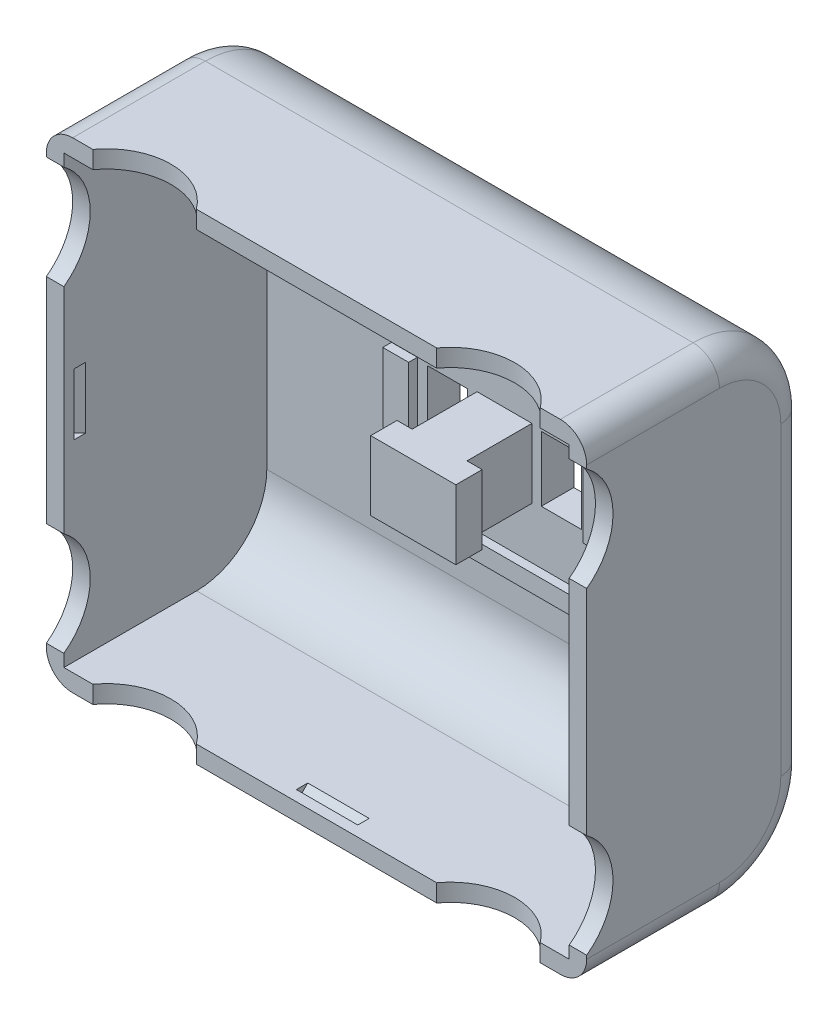
from build123d import *

# Parameters (mm, degrees)
EXTRUDE_1_DEPTH     = 61.6
SHELL_1_T           = -2
FILLET_2_R          = 3
CUT_EXTRUDE_1_REACH = 88.192
SKETCH_3_W          = 4.6
SKETCH_3_H          = 7.4
SKETCH_4_W          = 4.6
SKETCH_4_H          = 7.4
EXTRUDE_2_DEPTH     = 1.7
SKETCH_5_W          = 2.95
SKETCH_5_H          = 7.9
SKETCH_5_W_2        = 25.755
SKETCH_5_H_2        = 2
EXTRUDE_3_DEPTH     = 1
EXTRUDE_4_DEPTH     = 7.897587
CUT_EXTRUDE_START   = -61.6
CUT_EXTRUDE_3_DEPTH = 61.6
CUT_EXTRUDE_START_2 = -54.8
CUT_EXTRUDE_4_DEPTH = 54.8
CUT_EXTRUDE_5_DEPTH = 3.5
CUT_EXTRUDE_6_DEPTH = 3.5


with BuildPart() as part:
    # ｽｹｯﾁ2 → ﾎﾞｽ - 押し出し1 (new body)
    with BuildSketch(Plane(origin=(0, 0, 0), x_dir=(0, 0, -1), z_dir=(1, 0, 0))):
        with BuildLine():
            Line((0, 0), (15.13, 0))
            ThreePointArc((15.13, 0), (22.201067812, 2.928932188), (25.13, 10))
            Line((25.13, 10), (25.13, 44.8))
            ThreePointArc((25.13, 44.8), (22.201067812, 51.871067812), (15.13, 54.8))
            Line((15.13, 54.8), (0, 54.8))
            Line((0, 54.8), (0, 0))
        make_face()
    extrude(amount=EXTRUDE_1_DEPTH)

    # ｼｪﾙ1
    shell_1_openings = [part.faces().sort_by_distance(p)[0] for p in [
        (30.8, 27.4, 0),
    ]]
    offset(amount=SHELL_1_T, openings=shell_1_openings, kind=Kind.INTERSECTION)

    # ﾌｨﾚｯﾄ2
    fillet_2_edges = [part.edges().sort_by_distance(p)[0] for p in [
        (61.6, 2.928932188, -22.201067812),
        (61.6, 27.4, -25.13),
        (61.6, 51.871067812, -22.201067812),
        (61.6, 54.8, -7.565),
        (0, 54.8, -7.565),
        (0, 51.871067812, -22.201067812),
        (0, 27.4, -25.13),
        (61.6, 0, -7.565),
        (0, 2.928932188, -22.201067812),
        (0, 0, -7.565),
    ]]
    fillet(fillet_2_edges, radius=FILLET_2_R)

    # ｽｹｯﾁ3 → ｶｯﾄ - 押し出し1 (cut, up to next)
    with BuildSketch(Plane(origin=(0, 0, -25.13), x_dir=(-1, 0, 0), z_dir=(0, 0, -1)), mode=Mode.PRIVATE) as cut_extrude_1_sk1:
        with Locations((-37.2975, 27.4)):
            Rectangle(SKETCH_3_W, SKETCH_3_H)
    cut_extrude_1_tool1 = extrude(cut_extrude_1_sk1.sketch, amount=-CUT_EXTRUDE_1_REACH, mode=Mode.PRIVATE) & part.part
    # ｽｹｯﾁ3 → ｶｯﾄ - 押し出し1 (cut, up to next)
    with BuildSketch(Plane(origin=(0, 0, -25.13), x_dir=(-1, 0, 0), z_dir=(0, 0, -1)), mode=Mode.PRIVATE) as cut_extrude_1_sk2:
        with Locations((-24.3025, 27.4)):
            Rectangle(SKETCH_3_W, SKETCH_3_H)
    cut_extrude_1_tool2 = extrude(cut_extrude_1_sk2.sketch, amount=-CUT_EXTRUDE_1_REACH, mode=Mode.PRIVATE) & part.part
    add(cut_extrude_1_tool1.solids().sort_by_distance((37.2975, 27.4, -25.13))[0], mode=Mode.SUBTRACT)
    add(cut_extrude_1_tool2.solids().sort_by_distance((24.3025, 27.4, -25.13))[0], mode=Mode.SUBTRACT)

    # ｽｹｯﾁ4 → ﾎﾞｽ - 押し出し2 (add)
    with BuildSketch(Plane.XY.offset(-23.13)):
        Polygon((17.9225, 15.575), (30.6725, 15.575), (43.6775, 15.575), (43.6775, 39.225), (30.6725, 39.225), (17.9225, 39.225), align=None)
        with Locations((24.3025, 27.4)):
            Rectangle(SKETCH_4_W, SKETCH_4_H, mode=Mode.SUBTRACT)
        with Locations((37.2975, 27.4)):
            Rectangle(SKETCH_4_W, SKETCH_4_H, mode=Mode.SUBTRACT)
    extrude(amount=EXTRUDE_2_DEPTH)

    # ｽｹｯﾁ5 → ﾎﾞｽ - 押し出し3 (add)
    with BuildSketch(Plane.XY.offset(-21.43)):
        with Locations((19.3975, 27.4)):
            Rectangle(SKETCH_5_W, SKETCH_5_H)
        with Locations((42.2025, 27.4)):
            Rectangle(SKETCH_5_W, SKETCH_5_H)
        with Locations((30.8, 38.225)):
            Rectangle(SKETCH_5_W_2, SKETCH_5_H_2)
        with Locations((30.8, 16.575)):
            Rectangle(SKETCH_5_W_2, SKETCH_5_H_2)
    extrude(amount=EXTRUDE_3_DEPTH)

    # ｽｹｯﾁ6 → ﾎﾞｽ - 押し出し4 (add)
    with BuildSketch(Plane(origin=(-6.518280687, 23.45241299, -44.223812227), x_dir=(1, 0, 0), z_dir=(0, 1, 0))):
        Polygon((34.190780687, -22.793812227), (40.445780687, -22.793812227), (40.445780687, -30.193812227), (42.170780687, -30.193812227), (42.170780687, -33.193812227), (32.465780687, -33.193812227), (32.465780687, -30.193812227), (34.190780687, -30.193812227), align=None)
    extrude(amount=EXTRUDE_4_DEPTH)

    # ｽｹｯﾁ8 → ｶｯﾄ - 押し出し3 (cut)
    with BuildSketch(Plane.ZY.offset(CUT_EXTRUDE_START)):
        with BuildLine():
            Line((0, 51.399152482), (0, 39.600847518))
            ThreePointArc((0, 39.600847518), (-3, 45.5), (0, 51.399152482))
        make_face()
        with BuildLine():
            Line((0, 15.199152482), (0, 3.400847518))
            ThreePointArc((0, 3.400847518), (-3, 9.3), (0, 15.199152482))
        make_face()
    extrude(amount=CUT_EXTRUDE_3_DEPTH, mode=Mode.SUBTRACT)

    # ｽｹｯﾁ9 → ｶｯﾄ - 押し出し4 (cut)
    with BuildSketch(Plane.XZ.offset(CUT_EXTRUDE_START_2)):
        with BuildLine():
            Line((56.299152482, 0), (44.500847518, 0))
            ThreePointArc((44.500847518, 0), (50.4, -3), (56.299152482, 0))
        make_face()
        with BuildLine():
            Line((17.099152482, 0), (5.300847518, 0))
            ThreePointArc((5.300847518, 0), (11.2, -3), (17.099152482, 0))
        make_face()
    extrude(amount=CUT_EXTRUDE_4_DEPTH, mode=Mode.SUBTRACT)

    # ｽｹｯﾁ11 → ｶｯﾄ - 押し出し5 (cut, symmetric)
    with BuildSketch(Plane(origin=(0, 27.4, 0), x_dir=(-1, 0, 0), z_dir=(0, -1, 0))):
        Polygon((-59.6, 1.176601917), (-59.6, 2.476687437), (-60.288664164, 1.788023273), (-60.288664164, 1.176601917), align=None)
        Polygon((-1.311335836, 1.176601917), (-2, 1.176601917), (-2, 2.476687437), (-1.311335836, 1.788023273), align=None)
    extrude(amount=CUT_EXTRUDE_5_DEPTH, both=True, mode=Mode.SUBTRACT)

    # ｽｹｯﾁ12 → ｶｯﾄ - 押し出し6 (cut, symmetric)
    with BuildSketch(Plane(origin=(30.8, 0, 0), x_dir=(0, 0, -1), z_dir=(1, 0, 0))):
        Polygon((2.501421356, 2), (1.201335836, 2), (1.201335836, 1.311335836), (1.812757192, 1.311335836), align=None)
        Polygon((1.812757192, 53.488664164), (2.501421356, 52.8), (1.201335836, 52.8), (1.201335836, 53.488664164), align=None)
    extrude(amount=CUT_EXTRUDE_6_DEPTH, both=True, mode=Mode.SUBTRACT)


solid = part.part
